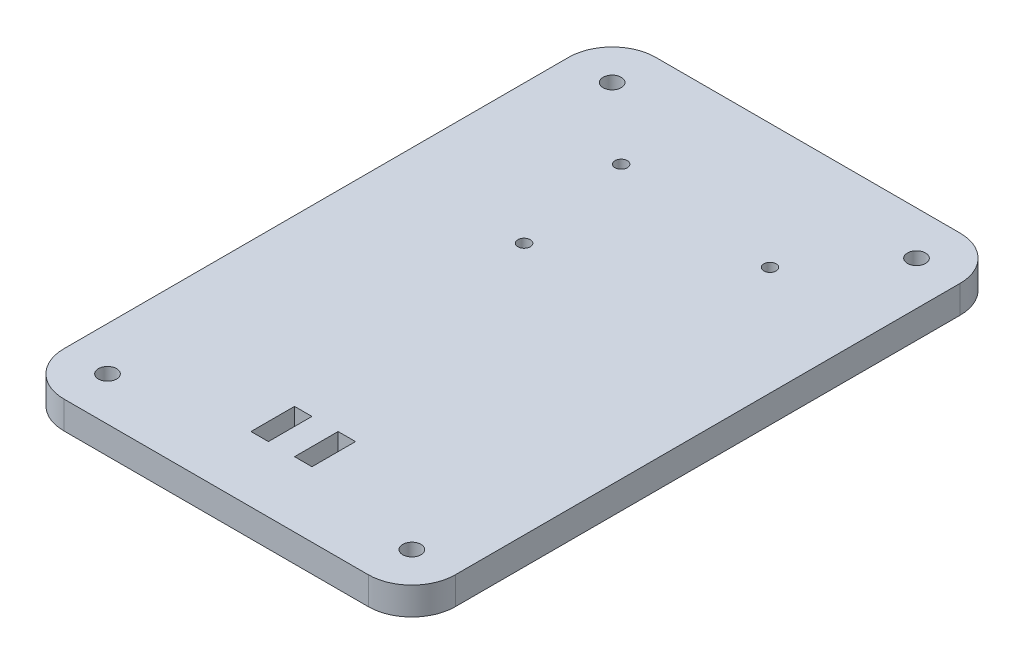
from build123d import *

# Parameters (mm, degrees)
SKETCH1_R           = 2.0828
SKETCH1_R_2         = 1.4224
SKETCH1_W           = 4
SKETCH1_H           = 10
BOSS_EXTRUDE1_DEPTH = 6.35


with BuildPart() as part:
    # Sketch1 → Boss-Extrude1 (new body)
    with BuildSketch(Plane(origin=(0, 0, 0), x_dir=(1, 0, 0), z_dir=(0, 1, 0))):
        with BuildLine():
            Line((-34.925, -67.912), (34.925, -67.912))
            ThreePointArc((34.925, -67.912), (41.996067812, -64.983067812), (44.925, -57.912))
            Line((44.925, -57.912), (44.925, 57.912))
            ThreePointArc((44.925, 57.912), (41.996067812, 64.983067812), (34.925, 67.912))
            Line((34.925, 67.912), (-34.925, 67.912))
            ThreePointArc((-34.925, 67.912), (-41.996067812, 64.983067812), (-44.925, 57.912))
            Line((-44.925, 57.912), (-44.925, -57.912))
            ThreePointArc((-44.925, -57.912), (-41.996067812, -64.983067812), (-34.925, -67.912))
        make_face()
        with Locations(Location((-34.925, 57.912, 0), (0, 0, 270))):
            Circle(SKETCH1_R, mode=Mode.SUBTRACT)
        with Locations(Location((34.925, 57.912, 0), (0, 0, 270))):
            Circle(SKETCH1_R, mode=Mode.SUBTRACT)
        with Locations(Location((34.925, -57.912, 0), (0, 0, 270))):
            Circle(SKETCH1_R, mode=Mode.SUBTRACT)
        with Locations(Location((-34.925, -57.912, 0), (0, 0, 270))):
            Circle(SKETCH1_R, mode=Mode.SUBTRACT)
        with Locations(Location((19.939, 39.276, 0), (0, 0, 270))):
            Circle(SKETCH1_R_2, mode=Mode.SUBTRACT)
        with Locations(Location((-13.081, 15.8572, 0), (0, 0, 270))):
            Circle(SKETCH1_R_2, mode=Mode.SUBTRACT)
        with Locations(Location((-17.653, 42.705, 0), (0, 0, 270))):
            Circle(SKETCH1_R_2, mode=Mode.SUBTRACT)
        with Locations((-5, -47.912)):
            Rectangle(SKETCH1_W, SKETCH1_H, mode=Mode.SUBTRACT)
        with Locations((5, -47.912)):
            Rectangle(SKETCH1_W, SKETCH1_H, mode=Mode.SUBTRACT)
    extrude(amount=BOSS_EXTRUDE1_DEPTH)


solid = part.part
